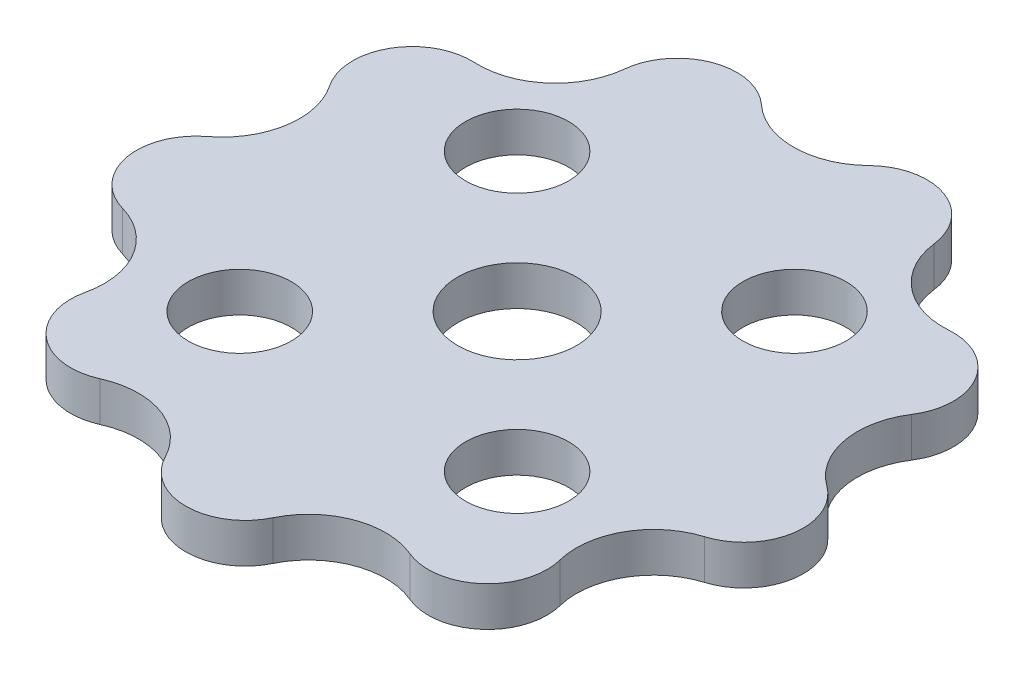
from build123d import *

# Parameters (mm, degrees)
BOSS_EXTRUDE1_DEPTH = 10
SKETCH2_R           = 13
CUT_EXTRUDE1_DEPTH  = 10
SKETCH3_R           = 15
CUT_EXTRUDE2_DEPTH  = 10


with BuildPart() as part:
    # Sketch1 → Boss-Extrude1 (new body)
    with BuildSketch(Plane(origin=(0, 0, 0), x_dir=(1, 0, 0), z_dir=(0, 1, 0))):
        with BuildLine():
            ThreePointArc((-14.287102681, 75.958258112), (-0.806955409, 70.759221722), (12.551119215, 76.264327736))
            ThreePointArc((12.551119215, 76.264327736), (27.96684553, 79.652976213), (37.880471551, 67.370974118))
            ThreePointArc((37.880471551, 67.370974118), (44.864987287, 54.723409538), (58.636480059, 50.354160551))
            ThreePointArc((58.636480059, 50.354160551), (72.623792794, 43.040978017), (72.32335215, 27.260062589))
            ThreePointArc((72.32335215, 27.260062589), (69.544103812, 13.081905848), (77.285180212, 0.882722021))
            ThreePointArc((77.285180212, 0.882722021), (83.299260286, -13.71037214), (72.925332493, -25.606135188))
            ThreePointArc((72.925332493, -25.606135188), (61.682761267, -34.680766977), (59.771285614, -49.001751954))
            ThreePointArc((59.771285614, -49.001751954), (54.998078122, -64.046486799), (39.404739288, -66.490937729))
            ThreePointArc((39.404739288, -66.490937729), (24.959369198, -66.2159235), (14.289742194, -75.957761595))
            ThreePointArc((14.289742194, -75.957761595), (0.962683969, -84.414538487), (-12.553769364, -76.263891543))
            ThreePointArc((-12.553769364, -76.263891543), (-23.442789112, -66.767913509), (-37.878130411, -67.37229041))
            ThreePointArc((-37.878130411, -67.37229041), (-53.523160712, -65.284089454), (-58.638229812, -50.352122925))
            ThreePointArc((-58.638229812, -50.352122925), (-60.875805858, -36.078454745), (-72.322404829, -27.262575782))
            ThreePointArc((-72.322404829, -27.262575782), (-82.964923652, -15.606489414), (-77.285210839, -0.880036389))
            ThreePointArc((-77.285210839, -0.880036389), (-69.824356485, 11.492513962), (-72.926222253, 25.603601044))
            ThreePointArc((-72.926222253, 25.603601044), (-73.586476763, 41.37356047), (-59.769582785, 49.003828954))
            ThreePointArc((-59.769582785, 49.003828954), (-46.101314701, 53.686007661), (-39.4070498, 66.489568389))
            ThreePointArc((-39.4070498, 66.489568389), (-29.776099574, 78.994461594), (-14.287102681, 75.958258112))
        make_face()
    extrude(amount=BOSS_EXTRUDE1_DEPTH)

    # Sketch2 → Cut-Extrude1 (cut)
    with BuildSketch(Plane(origin=(0, 10, 0), x_dir=(-1, 0, 0), z_dir=(0, 1, 0))):
        with Locations(Location((-35, 35, 0), (0, 0, 90))):
            Circle(SKETCH2_R)
        with Locations(Location((35, 35, 0), (0, 0, 90))):
            Circle(SKETCH2_R)
        with Locations(Location((35, -35, 0), (0, 0, 90))):
            Circle(SKETCH2_R)
        with Locations(Location((-35, -35, 0), (0, 0, 90))):
            Circle(SKETCH2_R)
    extrude(amount=-CUT_EXTRUDE1_DEPTH, mode=Mode.SUBTRACT)

    # Sketch3 → Cut-Extrude2 (cut)
    with BuildSketch(Plane(origin=(0, 10, 0), x_dir=(1, 0, 0), z_dir=(0, 1, 0))):
        with Locations(Location((0, 0, 0), (0, 0, 270))):
            Circle(SKETCH3_R)
    extrude(amount=-CUT_EXTRUDE2_DEPTH, mode=Mode.SUBTRACT)


solid = part.part
